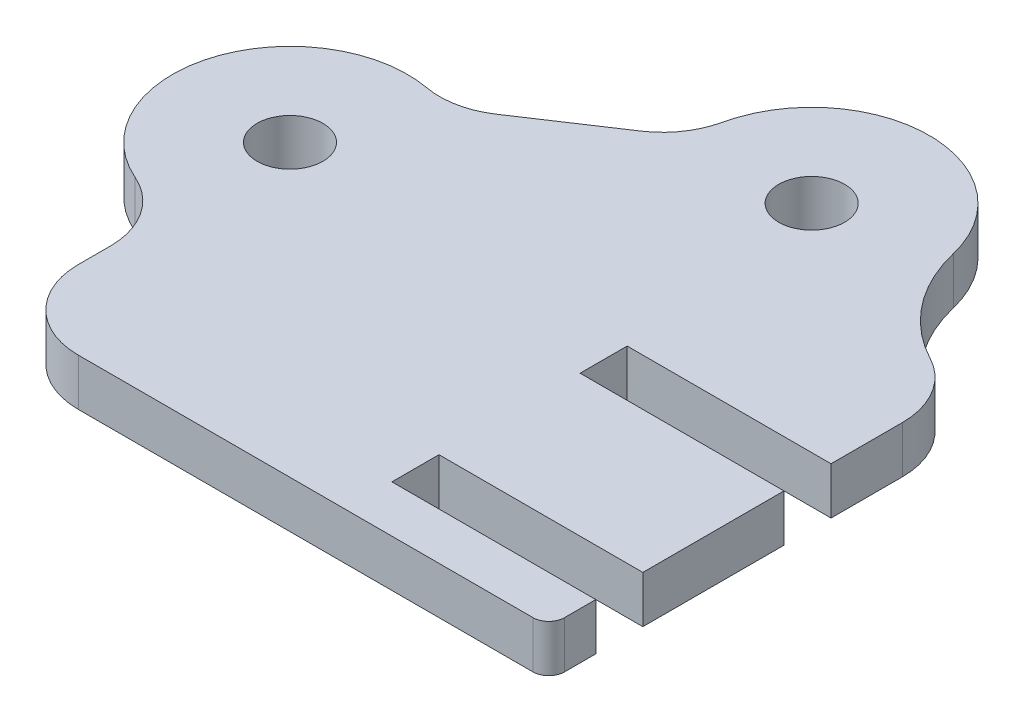
from build123d import *

# Parameters (mm, degrees)
SKETCH1_R           = 2.1
BOSS_EXTRUDE1_DEPTH = 3
FILLET1_R           = 5
SKETCH2_W           = 8
SKETCH2_H           = 3
CUT_EXTRUDE1_DEPTH  = 3
BOSS_EXTRUDE2_DEPTH = 3
FILLET2_R           = 10
SKETCH5_W           = 13
SKETCH5_H           = 3
CUT_EXTRUDE3_DEPTH  = 3.5
FILLET3_R           = 5
FILLET4_R           = 1


with BuildPart() as part:
    # Sketch1 → Boss-Extrude1 (new body)
    with BuildSketch(Plane(origin=(0, 0, 0), x_dir=(1, 0, 0), z_dir=(0, 1, 0))):
        with BuildLine():
            Line((0, -11.456439237), (0, -18.5))
            Line((0, -18.5), (30, -18.5))
            Line((30, -18.5), (30, -10.955880937))
            ThreePointArc((30, -10.955880937), (29.758770483, -9.587800364), (29.064177772, -8.384730498))
            Line((29.064177772, -8.384730498), (22.591994863, -0.671483264))
            ThreePointArc((22.591994863, -0.671483264), (21.491397009, 3.371317526), (23.853330247, 6.832072535))
            ThreePointArc((23.853330247, 6.832072535), (24.386195315, 19.350189707), (12.677699795, 14.889434685))
            ThreePointArc((12.677699795, 14.889434685), (11.918282987, 13.141523465), (10.560020318, 11.804725034))
            Line((10.560020318, 11.804725034), (5.017813295, 8.128440794))
            ThreePointArc((5.017813295, 8.128440794), (3.258028142, 7.396960283), (1.352375582, 7.377064476))
            ThreePointArc((1.352375582, 7.377064476), (-7.172928544, 2.190683933), (-3, -6.873863542))
            ThreePointArc((-3, -6.873863542), (-0.816699867, -8.71782645), (0, -11.456439237))
        make_face()
        with Locations(Location((0, 0, 0), (0, 0, 270))):
            Circle(SKETCH1_R, mode=Mode.SUBTRACT)
        with Locations(Location((20, 13.266499161, 0), (0, 0, 270))):
            Circle(SKETCH1_R, mode=Mode.SUBTRACT)
    extrude(amount=BOSS_EXTRUDE1_DEPTH)

    # Fillet1
    fillet1_edges = [part.edges().sort_by_distance(p)[0] for p in [
        (0, 1.5, 18.5),
    ]]
    fillet(fillet1_edges, radius=FILLET1_R)

    # Sketch2 → Cut-Extrude1 (cut)
    with BuildSketch(Plane(origin=(0, 3, 0), x_dir=(1, 0, 0), z_dir=(0, 1, 0))):
        with Locations((26, -14)):
            Rectangle(SKETCH2_W, SKETCH2_H)
    extrude(amount=-CUT_EXTRUDE1_DEPTH, mode=Mode.SUBTRACT)

    # Sketch4 → Boss-Extrude2 (add)
    with BuildSketch(Plane(origin=(0, 3, 0), x_dir=(1, 0, 0), z_dir=(0, 1, 0))):
        Polygon((27.12691506, 10.930459408), (35, 7.210028784), (35, -0.5), (22, -0.5), (22, -3.5), (35, -3.5), (35, -12.5), (22, -12.5), (22, -15.5), (35, -15.5), (35, -18.5), (18.101899038, -18.5), (15.526805317, 5.265582811), align=None)
    extrude(amount=-BOSS_EXTRUDE2_DEPTH)

    # Fillet2
    fillet2_edges = [part.edges().sort_by_distance(p)[0] for p in [
        (27.12691506, 1.5, -10.930459408),
    ]]
    fillet(fillet2_edges, radius=FILLET2_R)

    # Sketch5 → Cut-Extrude3 (cut)
    with BuildSketch(Plane(origin=(0, 3, 0), x_dir=(1, 0, 0), z_dir=(0, 1, 0))):
        with Locations((28.5, -2)):
            Rectangle(SKETCH5_W, SKETCH5_H)
    extrude(amount=-CUT_EXTRUDE3_DEPTH, mode=Mode.SUBTRACT)

    # Fillet3
    fillet3_edges = [part.edges().sort_by_distance(p)[0] for p in [
        (35, 1.5, -7.210028784),
    ]]
    fillet(fillet3_edges, radius=FILLET3_R)

    # Fillet4
    fillet4_edges = [part.edges().sort_by_distance(p)[0] for p in [
        (35, 1.5, 18.5),
    ]]
    fillet(fillet4_edges, radius=FILLET4_R)


solid = part.part
